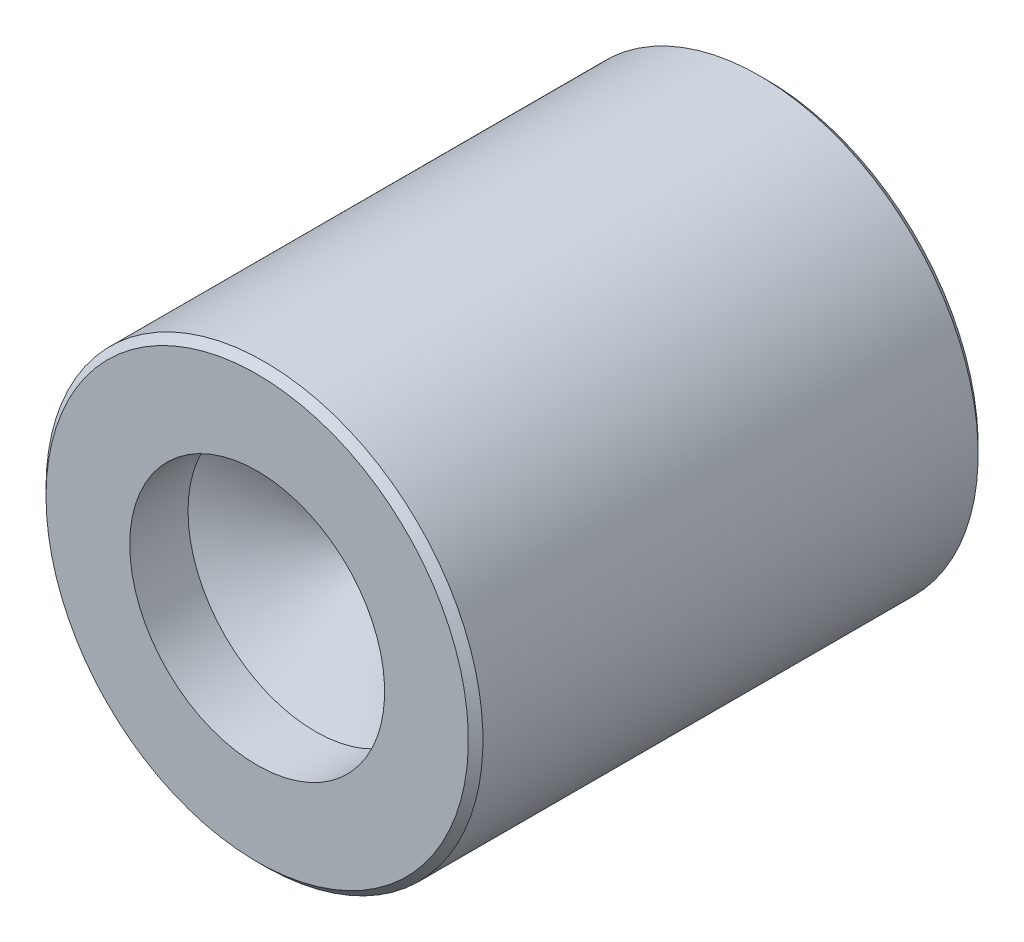
from build123d import *


with BuildPart() as part:
    # Esquisse1 → Révolution1 (revolve)
    with BuildSketch(Plane.XZ, mode=Mode.PRIVATE) as r_volution1_sk:
        Polygon((16.770833333, 59.416666667), (0, 49.339733368), (0, 0), (27.791666667, 0), (28.75, 0.958333333), (28.75, 66.125), (27.791666667, 67.083333333), (16.770833333, 67.083333333), align=None)
    revolve(r_volution1_sk.sketch.rotate(Axis((0, 0, 67.083333333), (0, 0, -1)), 180), axis=Axis((0, 0, 67.083333333), (0, 0, -1)))


solid = part.part
